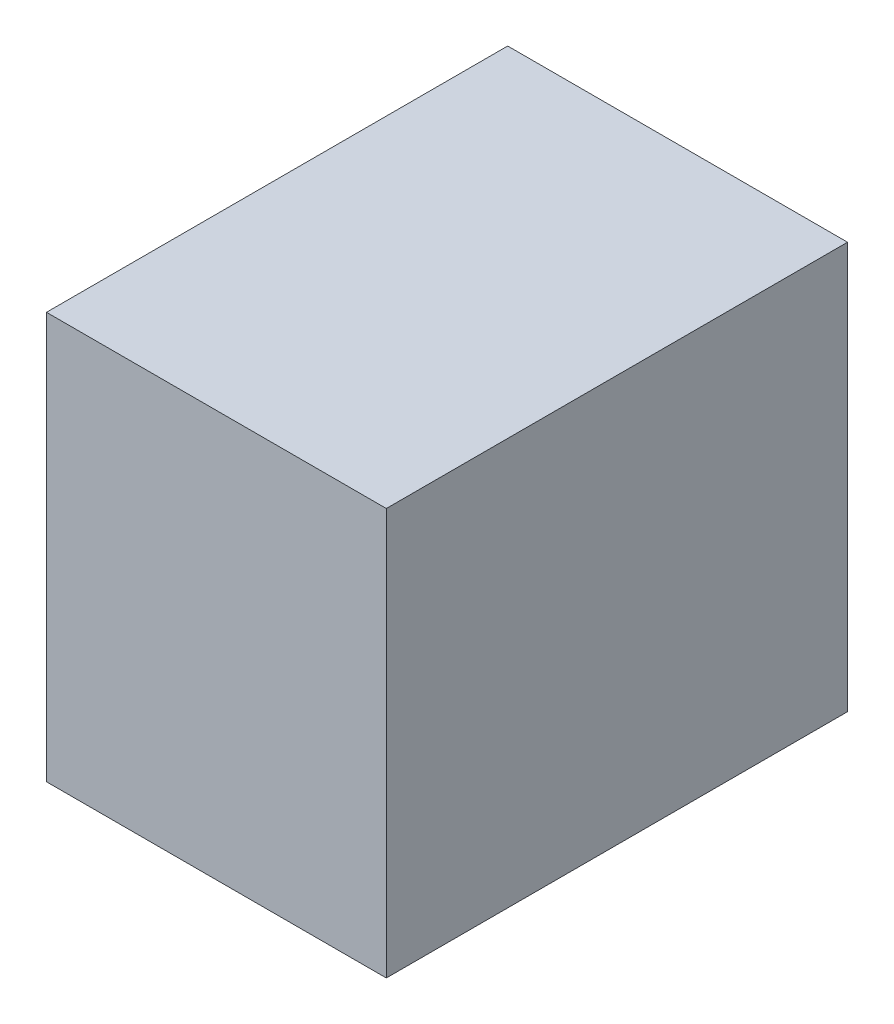
from build123d import *

# Parameters (mm, degrees)
SKETCH_1_W      = 56
SKETCH_1_H      = 76
EXTRUDE_1_DEPTH = 67


with BuildPart() as part:
    # 草图1 → 凸台-拉伸1 (new body)
    with BuildSketch(Plane(origin=(0, 0, 0), x_dir=(1, 0, 0), z_dir=(0, 1, 0))):
        with Locations((28, -38)):
            Rectangle(SKETCH_1_W, SKETCH_1_H)
    extrude(amount=EXTRUDE_1_DEPTH)


solid = part.part
